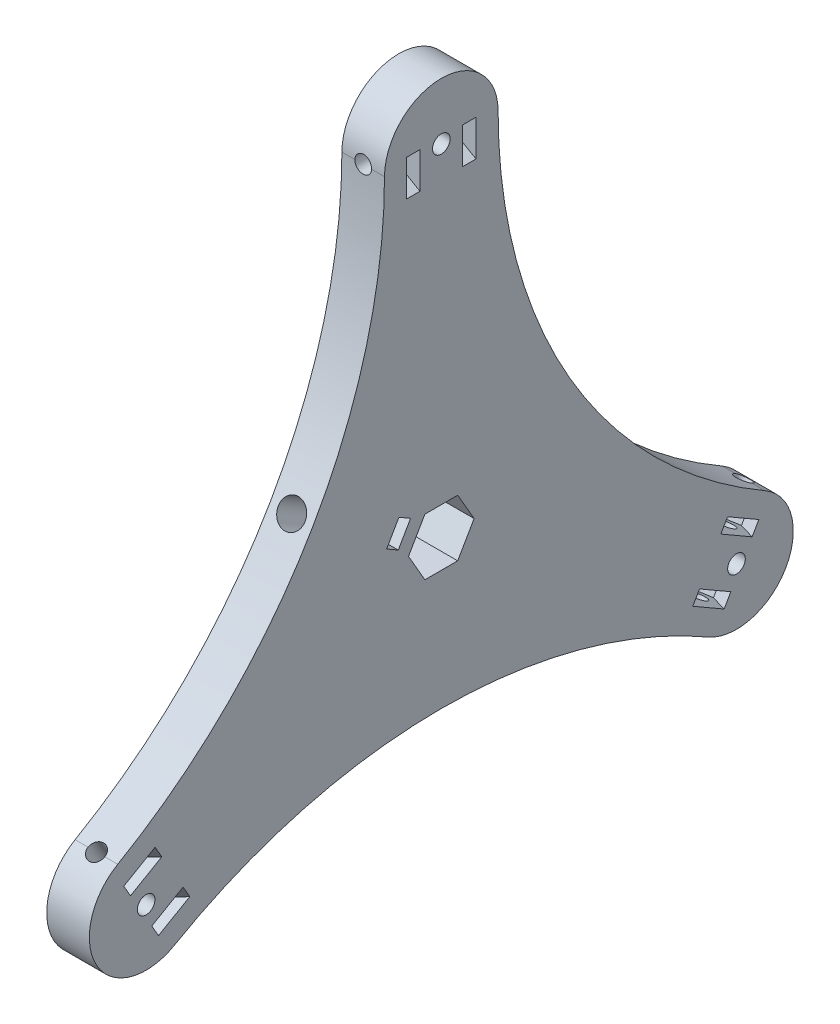
from build123d import *

# Parameters (mm, degrees)
SKETCH1_R                   = 1.9685
BOSS_EXTRUDE1_DEPTH         = 9.525
SKETCH3_R                   = 1.6
CUT_EXTRUDE1_DEPTH          = 121.530179668
CUT_EXTRUDE2_START          = -3.175
CUT_EXTRUDE2_DEPTH          = 3
CUT_EXTRUDE3_REACH          = 128.979
CUT_EXTRUDE3_END_RADIUS     = 119.282271537
CUT_EXTRUDE3_START          = -4.7625
SKETCH5_R                   = 2.999994
SKETCH6_R                   = 1.875
CUT_EXTRUDE4_DEPTH          = 120.105963224
CUT_EXTRUDE5_START          = -4.7625
CUT_EXTRUDE5_DEPTH          = 3
CIRPATTERN1_COUNT           = 3
CIRPATTERN1_COPY_1_SKETCH_R = 1.875
CIRPATTERN1_COPY_1_DEPTH    = 120.105963224
CIRPATTERN1_COPY_2_SKETCH_R = 1.875
CIRPATTERN1_COPY_2_DEPTH    = 120.105963224
CIRPATTERN1_START           = -4.7625
CIRPATTERN1_COPY_3_DEPTH    = 3
CIRPATTERN1_COPY_4_DEPTH    = 3
CIRPATTERN1_COPY_5_SKETCH_R = 1.875
CIRPATTERN1_COPY_5_DEPTH    = 120.105963224
CIRPATTERN1_COPY_6_SKETCH_R = 1.875
CIRPATTERN1_COPY_6_DEPTH    = 120.105963224


with BuildPart() as part:
    # Sketch1 → Boss-Extrude1 (new body)
    with BuildSketch(Plane(origin=(0, 0, 0), x_dir=(0, 0, -1), z_dir=(1, 0, 0))):
        with BuildLine():
            ThreePointArc((72.341135768, -27.101477372), (28.680794165, 16.558864232), (12.7, 76.2))
            ThreePointArc((12.7, 76.2), (0, 88.9), (-12.7, 76.2))
            ThreePointArc((-12.7, 76.2), (-28.680794165, 16.558864232), (-72.341135768, -27.101477372))
            ThreePointArc((-72.341135768, -27.101477372), (-76.989658396, -44.45), (-59.641135768, -49.098522628))
            ThreePointArc((-59.641135768, -49.098522628), (0, -33.117728463), (59.641135768, -49.098522628))
            ThreePointArc((59.641135768, -49.098522628), (76.989658396, -44.45), (72.341135768, -27.101477372))
        make_face()
        with Locations((-65.991135768, -38.1)):
            Circle(SKETCH1_R, mode=Mode.SUBTRACT)
        Polygon((-7.332348419, 0), (-3.666174209, 6.35), (3.666174209, 6.35), (7.332348419, 0), (3.666174209, -6.35), (-3.666174209, -6.35), align=None, mode=Mode.SUBTRACT)
        with Locations((65.991135768, -38.1)):
            Circle(SKETCH1_R, mode=Mode.SUBTRACT)
        with Locations((0, 76.2)):
            Circle(SKETCH1_R, mode=Mode.SUBTRACT)
    extrude(amount=BOSS_EXTRUDE1_DEPTH)

    # Sketch3 → Cut-Extrude1 (cut, through all)
    with BuildSketch(Plane(origin=(0, 3.175, 5.499261314), x_dir=(-1, 0, 0), z_dir=(0, -0.4999999999999999, -0.8660254037844387))):
        with Locations((-4.7625, 0)):
            Circle(SKETCH3_R)
    extrude(amount=-CUT_EXTRUDE1_DEPTH, mode=Mode.SUBTRACT)

    # Sketch4 → Cut-Extrude2 (cut)
    with BuildSketch(Plane(origin=(0, 3.175, 5.499261314), x_dir=(-1, 0, 0), z_dir=(0, -0.4999999999999999, -0.8660254037844387)).offset(CUT_EXTRUDE2_START)):
        Polygon((-3.174786782, 2.749999961), (-6.350213218, 2.749999961), (-9.525, 2.749999961), (-9.525, -2.749999961), (-6.350213218, -2.749999961), (-3.174786782, -2.749999961), (-1.587073564, 0), align=None)
    extrude(amount=-CUT_EXTRUDE2_DEPTH, mode=Mode.SUBTRACT)

    # Cut-Extrude3: up to this cylinder (the profile starts outside it)
    cut_extrude3_end = Plane(origin=(4.7625, 76.2, 131.982271537), z_dir=(-1, 0, 0)) * Cylinder(CUT_EXTRUDE3_END_RADIUS, 497.522543073, mode=Mode.PRIVATE)
    # Sketch5 → Cut-Extrude3 (cut, up to the surface)
    with BuildSketch(Plane(origin=(0, 6.2625, 10.846968182), x_dir=(-1, 0, 0), z_dir=(0, -0.5000000000000001, -0.8660254037844387)).offset(CUT_EXTRUDE3_START), mode=Mode.PRIVATE) as cut_extrude3_sk1:
        with Locations((-4.7625, 0)):
            Circle(SKETCH5_R)
    cut_extrude3_tool1 = extrude(cut_extrude3_sk1.sketch, amount=-CUT_EXTRUDE3_REACH, mode=Mode.PRIVATE) - cut_extrude3_end
    add(cut_extrude3_tool1.solids().sort_by_distance((4.7625, 8.64375, 14.971414))[0], mode=Mode.SUBTRACT)

    # Sketch6 → Cut-Extrude4 (cut, through all)
    with BuildSketch(Plane.XY):
        with Locations((4.7625, 76.2)):
            Circle(SKETCH6_R)
    cut_extrude4 = extrude(amount=-CUT_EXTRUDE4_DEPTH, mode=Mode.SUBTRACT)

    # Sketch7 → Cut-Extrude5 (cut)
    with BuildSketch(Plane.XY.offset(CUT_EXTRUDE5_START)):
        Polygon((8.2625, 78.220725942), (9.525, 77.491821227), (9.525, 69.408917459), (4.7625, 72.158548116), (1.2625, 74.179274058), (1.2625, 78.220725942), (4.7625, 80.241451884), align=None)
    cut_extrude5 = extrude(amount=-CUT_EXTRUDE5_DEPTH, mode=Mode.SUBTRACT)

    # Mirror1: Cut-Extrude4, Cut-Extrude5 across plane
    add(cut_extrude4.mirror(Plane.XY), mode=Mode.SUBTRACT)
    add(cut_extrude5.mirror(Plane.XY), mode=Mode.SUBTRACT)

    # CirPattern1: Cut-Extrude5 ×3 about axis
    cirpattern1_axis = Axis((-0.47625, 0, 0), (1, 0, 0))
    for i in range(1, CIRPATTERN1_COUNT):
        add(cut_extrude5.rotate(cirpattern1_axis, i * 360 / CIRPATTERN1_COUNT), mode=Mode.SUBTRACT)

    # CirPattern1 copy 1 sketch → CirPattern1 copy 1 (cut, through all)
    with BuildSketch(Plane(origin=(0, 0, 0), x_dir=(1, 0, 0), z_dir=(0, 0.8660254037844387, 0.4999999999999998))):
        with Locations((4.7625, -76.2)):
            Circle(CIRPATTERN1_COPY_1_SKETCH_R)
    extrude(amount=-CIRPATTERN1_COPY_1_DEPTH, mode=Mode.SUBTRACT)

    # CirPattern1 copy 2 sketch → CirPattern1 copy 2 (cut, through all)
    with BuildSketch(Plane(origin=(0, 0, 0), x_dir=(1, 0, 0), z_dir=(0, -0.8660254037844384, 0.5000000000000004))):
        with Locations((4.7625, -76.2)):
            Circle(CIRPATTERN1_COPY_2_SKETCH_R)
    extrude(amount=-CIRPATTERN1_COPY_2_DEPTH, mode=Mode.SUBTRACT)

    # CirPattern1 copy 3 sketch → CirPattern1 copy 3 (cut)
    with BuildSketch(Plane(origin=(0, 0, 0), x_dir=(1, 0, 0), z_dir=(0, 0.8660254037844387, 0.4999999999999998)).offset(CIRPATTERN1_START)):
        Polygon((8.2625, -78.220725942), (9.525, -77.491821227), (9.525, -69.408917459), (4.7625, -72.158548116), (1.2625, -74.179274058), (1.2625, -78.220725942), (4.7625, -80.241451884), align=None)
    extrude(amount=-CIRPATTERN1_COPY_3_DEPTH, mode=Mode.SUBTRACT)

    # CirPattern1 copy 4 sketch → CirPattern1 copy 4 (cut)
    with BuildSketch(Plane(origin=(0, 0, 0), x_dir=(1, 0, 0), z_dir=(0, -0.8660254037844384, 0.5000000000000004)).offset(CIRPATTERN1_START)):
        Polygon((8.2625, -78.220725942), (9.525, -77.491821227), (9.525, -69.408917459), (4.7625, -72.158548116), (1.2625, -74.179274058), (1.2625, -78.220725942), (4.7625, -80.241451884), align=None)
    extrude(amount=-CIRPATTERN1_COPY_4_DEPTH, mode=Mode.SUBTRACT)

    # CirPattern1 copy 5 sketch → CirPattern1 copy 5 (cut, through all)
    with BuildSketch(Plane(origin=(0, 0, 0), x_dir=(1, 0, 0), z_dir=(0, -0.8660254037844387, -0.4999999999999998))):
        with Locations((4.7625, 76.2)):
            Circle(CIRPATTERN1_COPY_5_SKETCH_R)
    extrude(amount=-CIRPATTERN1_COPY_5_DEPTH, mode=Mode.SUBTRACT)

    # CirPattern1 copy 6 sketch → CirPattern1 copy 6 (cut, through all)
    with BuildSketch(Plane(origin=(0, 0, 0), x_dir=(1, 0, 0), z_dir=(0, 0.8660254037844384, -0.5000000000000004))):
        with Locations((4.7625, 76.2)):
            Circle(CIRPATTERN1_COPY_6_SKETCH_R)
    extrude(amount=-CIRPATTERN1_COPY_6_DEPTH, mode=Mode.SUBTRACT)


solid = part.part
